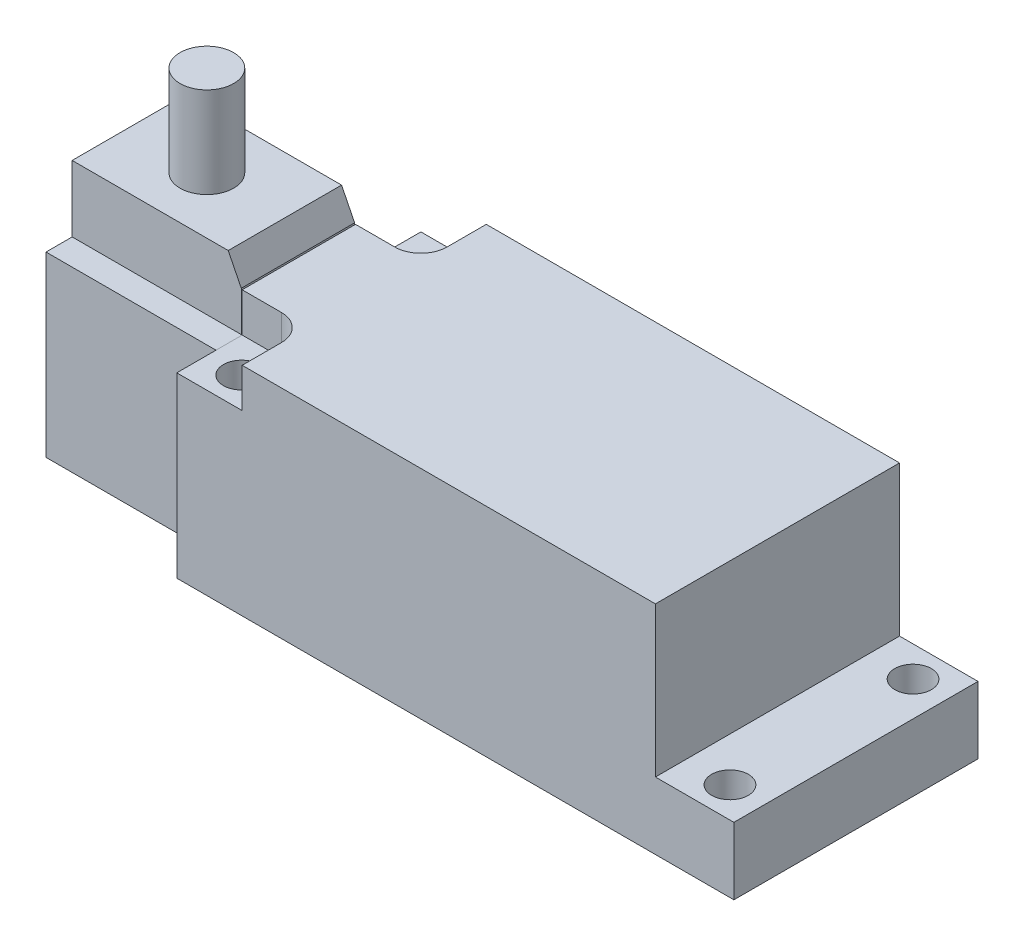
from build123d import *

# Parameters (mm, degrees)
SKETCH1_W             = 63.9
SKETCH1_H             = 28
EXTRUDE1_DEPTH        = 24.9
SKETCH2_W             = 9
SKETCH2_H             = 17.2
CUT_EXTRUDE1_DEPTH    = 75.075772018
CUT_EXTRUDE2_DEPTH    = 4.5
M5X0_8_TAPPED_HOLE4_D = 4.2
SKETCH11_W            = 19.5
SKETCH11_H            = 19
EXTRUDE2_DEPTH        = 20.4
SKETCH12_W            = 19.4
SKETCH12_H            = 13
EXTRUDE4_DEPTH        = 7.6
CHAMFER1_SIZE         = 1.5
CHAMFER1_SIZE2        = 3
SKETCH13_R            = 3.075
EXTRUDE5_DEPTH        = 10.4


with BuildPart() as part:
    # Sketch1 → Extrude1 (new body)
    with BuildSketch(Plane(origin=(0, 0, 0), x_dir=(1, 0, 0), z_dir=(0, 1, 0))):
        with Locations((31.95, 0)):
            Rectangle(SKETCH1_W, SKETCH1_H)
    extrude(amount=EXTRUDE1_DEPTH)

    # Sketch2 → Cut-Extrude1 (cut, through all)
    with BuildSketch(Plane.XY.offset(14)):
        with Locations((59.4, 16.3)):
            Rectangle(SKETCH2_W, SKETCH2_H)
    extrude(amount=-CUT_EXTRUDE1_DEPTH, mode=Mode.SUBTRACT)

    # Sketch3 → Cut-Extrude2 (cut)
    with BuildSketch(Plane(origin=(0, 24.9, 0), x_dir=(-1, 0, 0), z_dir=(0, 1, 0))):
        with BuildLine():
            Line((-7.5, -14), (-7.5, -9.5))
            ThreePointArc((-7.5, -9.5), (-6.621320344, -7.378679656), (-4.5, -6.5))
            Line((-4.5, -6.5), (0, -6.5))
            Line((0, -6.5), (0, -14))
            Line((0, -14), (-7.5, -14))
        make_face()
        with BuildLine():
            Line((0, 14), (-7.5, 14))
            Line((-7.5, 14), (-7.5, 9.5))
            ThreePointArc((-7.5, 9.5), (-6.621320344, 7.378679656), (-4.5, 6.5))
            Line((-4.5, 6.5), (0, 6.5))
            Line((0, 6.5), (0, 14))
        make_face()
    extrude(amount=-CUT_EXTRUDE2_DEPTH, mode=Mode.SUBTRACT)

    # M5x0.8 Tapped Hole4 (through all)
    with Locations(Plane(origin=(3.95, 0, 10.5), x_dir=(0, 0, -1), z_dir=(0, -1, 0))):
        with Locations((0, 0), (21, 0), (0, 56), (21, 56)):
            Hole(M5X0_8_TAPPED_HOLE4_D / 2)


with BuildPart() as body_2:
    # Sketch11 → Extrude2 (new body)
    with BuildSketch(Plane.XZ):
        with Locations((-9.75, 0)):
            Rectangle(SKETCH11_W, SKETCH11_H)
    extrude(amount=-EXTRUDE2_DEPTH)

    # Sketch12 → Extrude4 (add)
    with BuildSketch(Plane(origin=(0, 20.4, 0), x_dir=(-1, 0, 0), z_dir=(0, 1, 0))):
        with Locations((9.8, 0)):
            Rectangle(SKETCH12_W, SKETCH12_H)
    extrude(amount=EXTRUDE4_DEPTH)

    # Chamfer1
    chamfer1_edges = [body_2.edges().sort_by_distance(p)[0] for p in [
        (-0.1, 28, 0),
    ]]
    chamfer1_side = [body_2.faces().sort_by_distance(p)[0] for p in [
        (-9.8, 28, 0),
    ]]
    chamfer(chamfer1_edges, length=CHAMFER1_SIZE, length2=CHAMFER1_SIZE2, reference=chamfer1_side[0])

    # Sketch13 → Extrude5 (add)
    with BuildSketch(Plane(origin=(0, 28, 0), x_dir=(-1, 0, 0), z_dir=(0, 1, 0))):
        with Locations(Location((10.55, 0, 0), (0, 0, 90))):
            Circle(SKETCH13_R)
    extrude(amount=EXTRUDE5_DEPTH)


solid = Compound([part.part, body_2.part])
